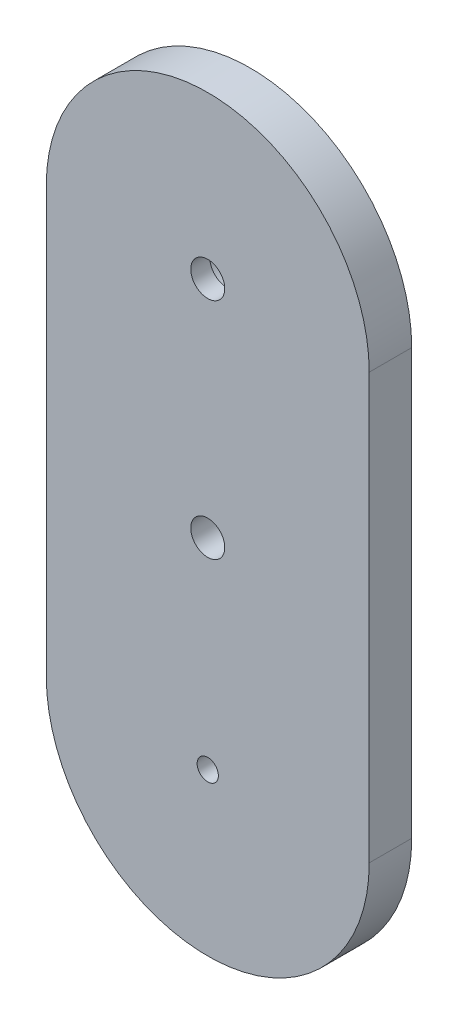
from build123d import *

# Parameters (mm, degrees)
CROQUIS1_R              = 2.5
CROQUIS1_R_2            = 8
CROQUIS1_R_3            = 4
SALIENTE_EXTRUIR1_DEPTH = 10
SALIENTE_EXTRUIR2_START = -4.5
CROQUIS2_R              = 8
CROQUIS2_R_2            = 4
SALIENTE_EXTRUIR2_DEPTH = 4.5


with BuildPart() as part:
    # Croquis1 → Saliente-Extruir1 (new body)
    with BuildSketch(Plane.XY):
        with BuildLine():
            Line((-38, 0), (-38, 100))
            ThreePointArc((-38, 100), (0, 138), (38, 100))
            Line((38, 100), (38, 0))
            ThreePointArc((38, 0), (0, -38), (-38, 0))
        make_face()
        Circle(CROQUIS1_R, mode=Mode.SUBTRACT)
        with Locations((0, 100)):
            Circle(CROQUIS1_R_2, mode=Mode.SUBTRACT)
        with Locations((0, 47.25)):
            Circle(CROQUIS1_R_3, mode=Mode.SUBTRACT)
    extrude(amount=SALIENTE_EXTRUIR1_DEPTH)

    # Croquis2 → Saliente-Extruir2 (add)
    with BuildSketch(Plane.XY.offset(10).offset(SALIENTE_EXTRUIR2_START)):
        with Locations((0, 100)):
            Circle(CROQUIS2_R)
        with Locations((0, 100)):
            Circle(CROQUIS2_R_2, mode=Mode.SUBTRACT)
    extrude(amount=SALIENTE_EXTRUIR2_DEPTH)


solid = part.part
